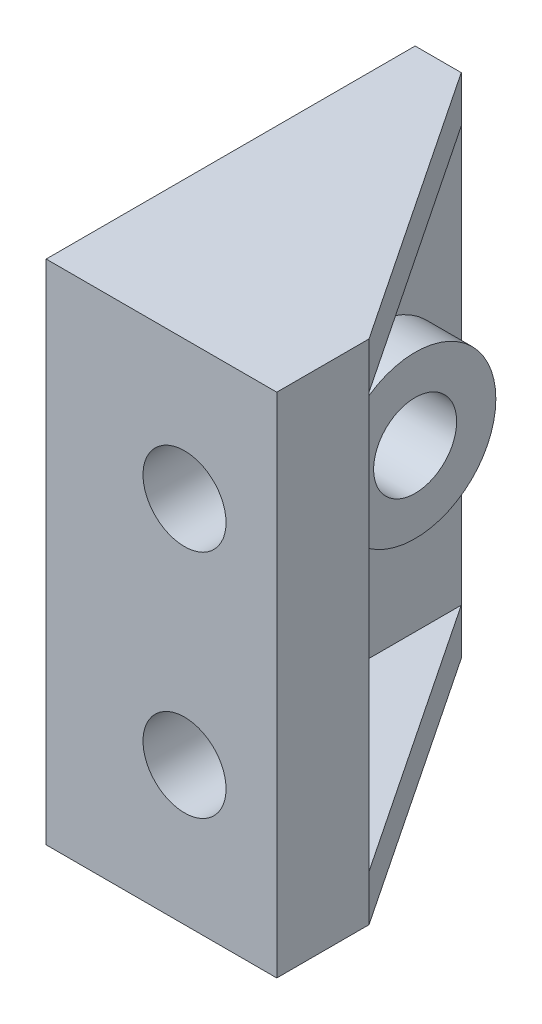
from build123d import *

# Parameters (mm, degrees)
BOSS_EXTRUDE1_DEPTH = 55
SKETCH7_W           = 30
SKETCH7_H           = 45
CUT_EXTRUDE5_DEPTH  = 20
CUT_EXTRUDE4_REACH  = 74.457
SKETCH6_R           = 4.5
SKETCH8_R           = 8.75
BOSS_EXTRUDE2_DEPTH = 5
CUT_EXTRUDE6_REACH  = 71.642
SKETCH9_R           = 4.5


with BuildPart() as part:
    # Sketch1 → Boss-Extrude1 (new body)
    with BuildSketch(Plane(origin=(0, 0, 0), x_dir=(1, 0, 0), z_dir=(0, 1, 0))):
        Polygon((0, 0), (0, -40), (25, -40), (25, -30), (5, 0), align=None)
    extrude(amount=BOSS_EXTRUDE1_DEPTH)

    # Sketch7 → Cut-Extrude5 (cut)
    with BuildSketch(Plane(origin=(25, 0, 0), x_dir=(0, 0, -1), z_dir=(1, 0, 0))):
        with Locations((-15, 27.5)):
            Rectangle(SKETCH7_W, SKETCH7_H)
    extrude(amount=-CUT_EXTRUDE5_DEPTH, mode=Mode.SUBTRACT)

    # Sketch6 → Cut-Extrude4 (cut, up to next)
    with BuildSketch(Plane.XY.offset(40), mode=Mode.PRIVATE) as cut_extrude4_sk1:
        with Locations((15, 40)):
            Circle(SKETCH6_R)
    cut_extrude4_tool1 = extrude(cut_extrude4_sk1.sketch, amount=-CUT_EXTRUDE4_REACH, mode=Mode.PRIVATE) & part.part
    # Sketch6 → Cut-Extrude4 (cut, up to next)
    with BuildSketch(Plane.XY.offset(40), mode=Mode.PRIVATE) as cut_extrude4_sk2:
        with Locations((15, 15)):
            Circle(SKETCH6_R)
    cut_extrude4_tool2 = extrude(cut_extrude4_sk2.sketch, amount=-CUT_EXTRUDE4_REACH, mode=Mode.PRIVATE) & part.part
    add(cut_extrude4_tool1.solids().sort_by_distance((15, 40, 40))[0], mode=Mode.SUBTRACT)
    add(cut_extrude4_tool2.solids().sort_by_distance((15, 15, 40))[0], mode=Mode.SUBTRACT)

    # Sketch8 → Boss-Extrude2 (add)
    with BuildSketch(Plane(origin=(5, 0, 0), x_dir=(0, 0, -1), z_dir=(1, 0, 0))):
        with Locations((-10, 27.5)):
            Circle(SKETCH8_R)
    extrude(amount=BOSS_EXTRUDE2_DEPTH)

    # Sketch9 → Cut-Extrude6 (cut, up to next)
    with BuildSketch(Plane(origin=(10, 0, 0), x_dir=(0, 0, -1), z_dir=(1, 0, 0)), mode=Mode.PRIVATE) as cut_extrude6_sk1:
        with Locations((-10, 27.5)):
            Circle(SKETCH9_R)
    cut_extrude6_tool1 = extrude(cut_extrude6_sk1.sketch, amount=-CUT_EXTRUDE6_REACH, mode=Mode.PRIVATE) & part.part
    add(cut_extrude6_tool1.solids().sort_by_distance((10, 27.5, 10))[0], mode=Mode.SUBTRACT)


solid = part.part
